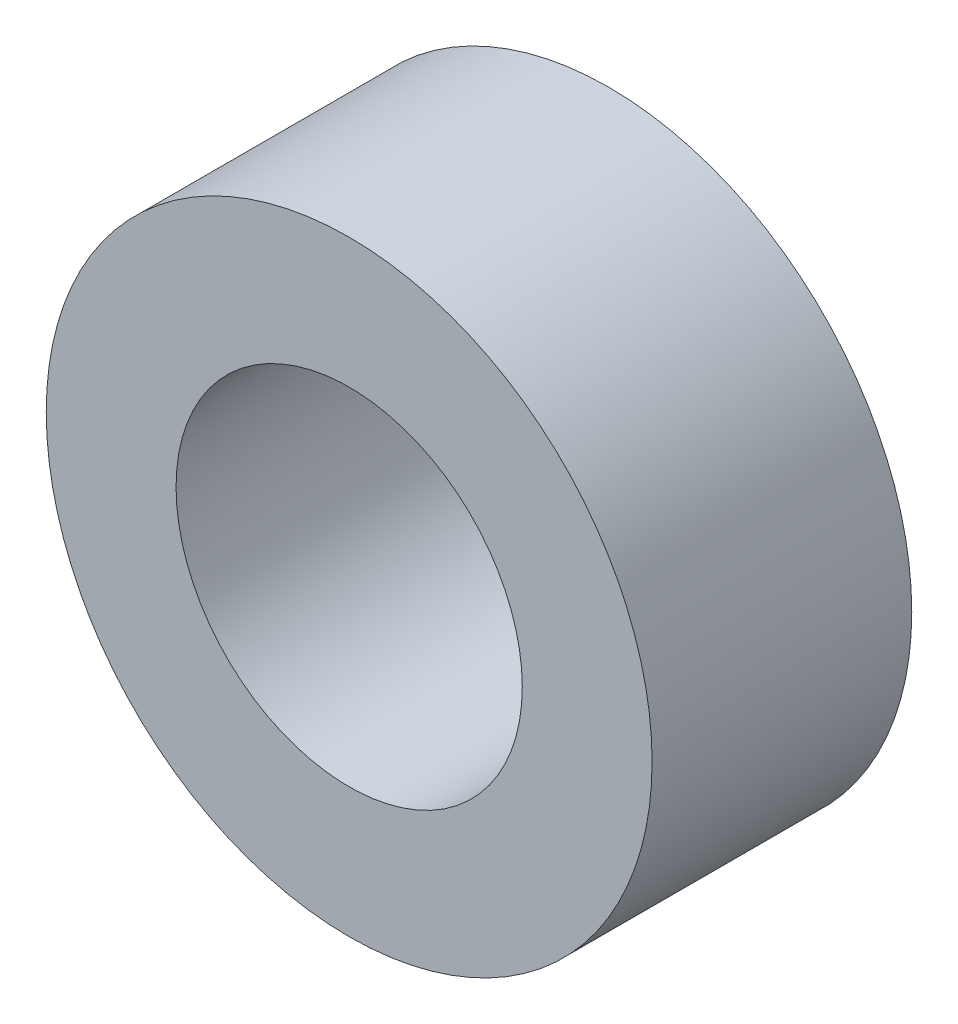
from build123d import *

# Parameters (mm, degrees)
SCHIZZO1_R                   = 7
SCHIZZO1_R_2                 = 4
ESTRUSIONE_ESTRUSIONE1_DEPTH = 6


with BuildPart() as part:
    # Schizzo1 → Estrusione-Estrusione1 (new body)
    with BuildSketch(Plane.XY):
        Circle(SCHIZZO1_R)
        Circle(SCHIZZO1_R_2, mode=Mode.SUBTRACT)
    extrude(amount=ESTRUSIONE_ESTRUSIONE1_DEPTH)


solid = part.part
